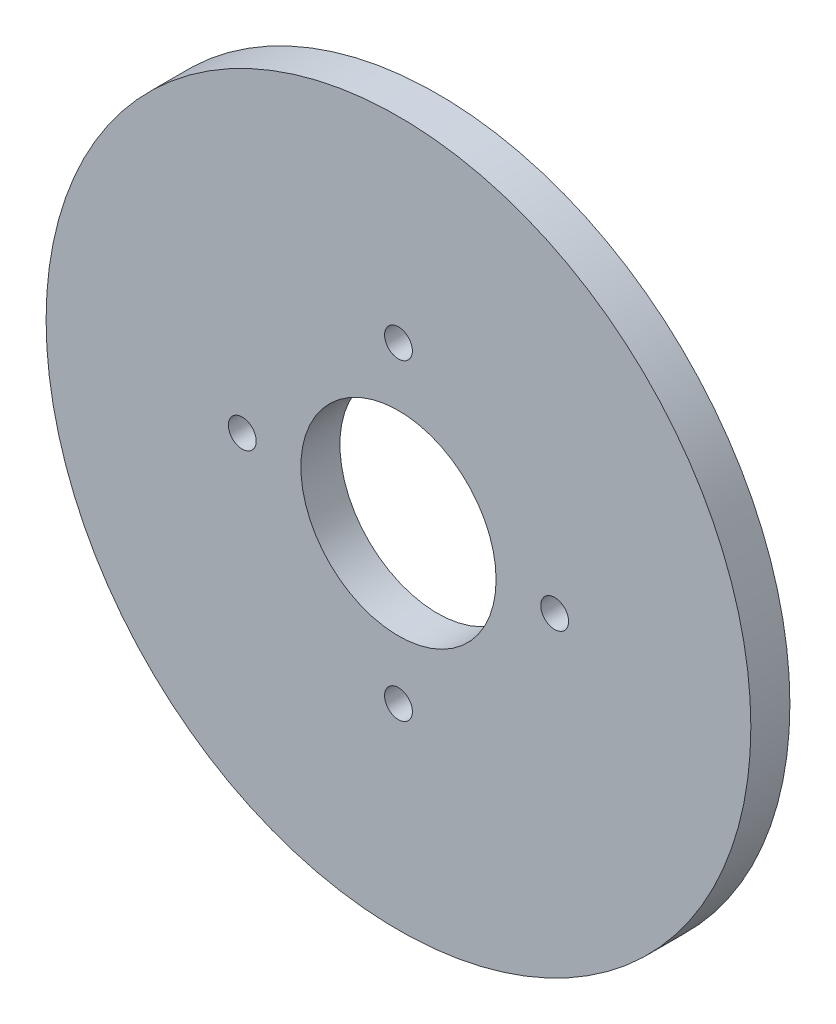
from build123d import *

# Parameters (mm, degrees)
SKETCH1_R                     = 28.6512
SKETCH1_R_2                   = 7.9375
BOSS_EXTRUDE1_DEPTH           = 3.175
TAP_DRILL_FOR_4_40_TAP1_D     = 2.2606
TAP_DRILL_FOR_4_40_TAP1_DEPTH = 4
TAP_DRILL_FOR_4_40_TAP1_TIP   = 0.679152758


with BuildPart() as part:
    # Sketch1 → Boss-Extrude1 (new body)
    with BuildSketch(Plane.XY):
        Circle(SKETCH1_R)
        Circle(SKETCH1_R_2, mode=Mode.SUBTRACT)
    extrude(amount=BOSS_EXTRUDE1_DEPTH)

    # Tap Drill for #4-40 Tap1
    with Locations(Plane.XY.offset(3.175)):
        with Locations((0, 12.7), (0, -12.7), (12.7, 0), (-12.7, 0)):
            Hole(TAP_DRILL_FOR_4_40_TAP1_D / 2, depth=TAP_DRILL_FOR_4_40_TAP1_DEPTH)
            with Locations((0, 0, -(TAP_DRILL_FOR_4_40_TAP1_DEPTH + TAP_DRILL_FOR_4_40_TAP1_TIP / 2))):  # 118° drill point
                Cone(0, TAP_DRILL_FOR_4_40_TAP1_D / 2, TAP_DRILL_FOR_4_40_TAP1_TIP, mode=Mode.SUBTRACT)


solid = part.part
